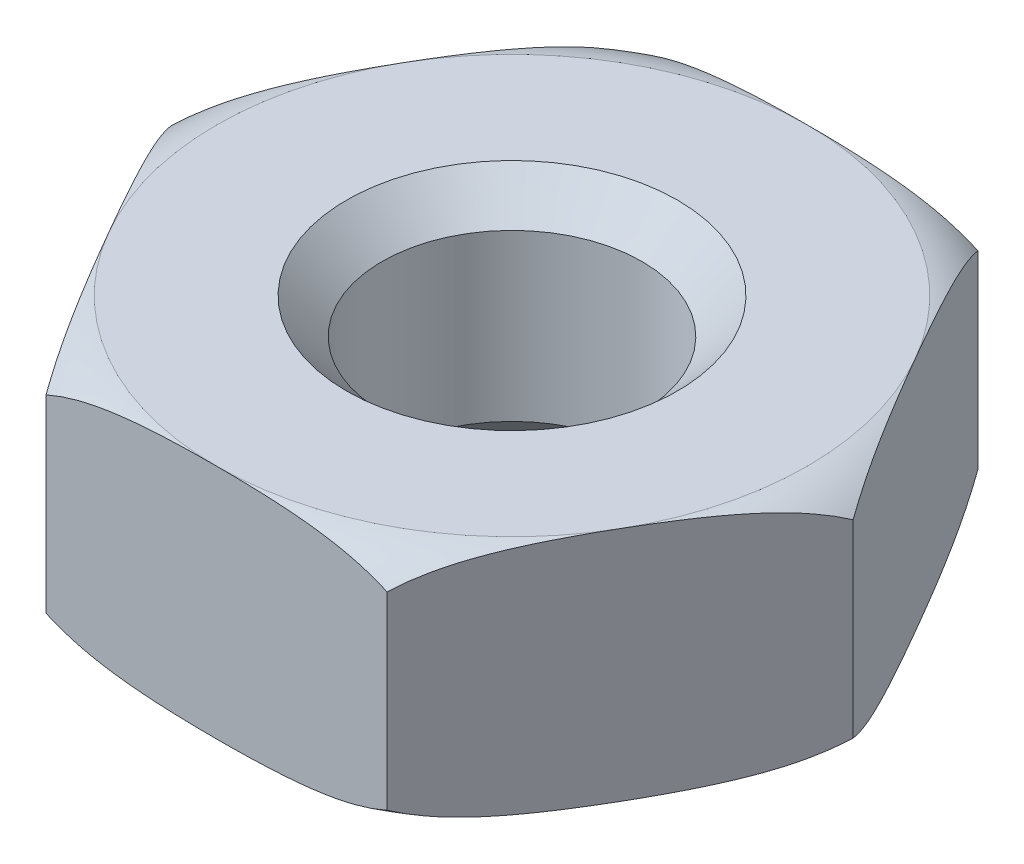
from build123d import *

# Parameters (mm, degrees)
SKETCH1_R           = 1.1
BOSS_EXTRUDE1_DEPTH = 1


with BuildPart() as part:
    # Sketch1 → Boss-Extrude1 (new, symmetric)
    with BuildSketch(Plane(origin=(0, 0, 0), x_dir=(1, 0, 0), z_dir=(0, 1, 0))):
        Polygon((2.886751346, 0), (1.443375673, 2.5), (-1.443375673, 2.5), (-2.886751346, 0), (-1.443375673, -2.5), (1.443375673, -2.5), align=None)
        with Locations(Location((0, 0, 0), (0, 0, 270))):
            Circle(SKETCH1_R, mode=Mode.SUBTRACT)
    extrude(amount=BOSS_EXTRUDE1_DEPTH, both=True)

    # Sketch2 → Cut-Revolve1 (revolve, cut)
    with BuildSketch(Plane.XY, mode=Mode.PRIVATE) as cut_revolve1_sk:
        with BuildLine():
            Line((-2.886751346, 0.800688001), (-2.886751346, 1))
            Line((-2.886751346, 1), (-2.5, 1))
            ThreePointArc((-2.5, 1), (-2.706403757, 0.925624109), (-2.886751346, 0.800688001))
        make_face()
        Polygon((-1.4, 1), (-1.1, 1), (-1.1, 0.7), align=None)
        with BuildLine():
            Line((-2.886751346, -0.800688001), (-2.886751346, -1))
            Line((-2.886751346, -1), (-2.5, -1))
            ThreePointArc((-2.5, -1), (-2.706403757, -0.925624109), (-2.886751346, -0.800688001))
        make_face()
    cut_revolve1 = revolve(cut_revolve1_sk.sketch.rotate(Axis((0, 0, 0), (0, 1, 0)), 270), axis=Axis((0, 0, 0), (0, 1, 0)), mode=Mode.SUBTRACT)

    # Mirror1: Cut-Revolve1 across plane
    add(cut_revolve1.mirror(Plane.ZX), mode=Mode.SUBTRACT)


solid = part.part
